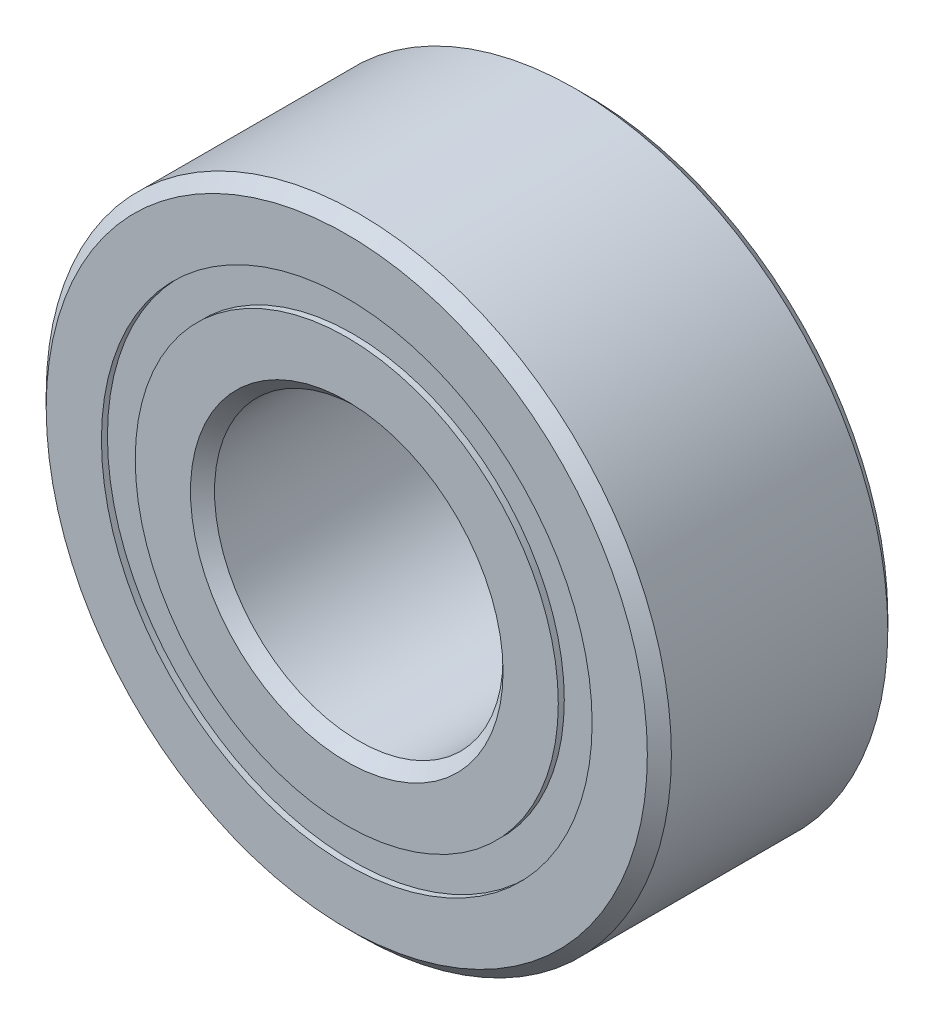
from build123d import *

# Parameters (mm, degrees)
CIRPATTERN1_COUNT = 12
SKETCH5_W         = 1.209571124
SKETCH5_H         = 0.703296704


with BuildPart() as part:
    # Sketch1 → Revolve1 (revolve)
    with BuildSketch(Plane(origin=(0, 0, 0), x_dir=(0, 0, -1), z_dir=(1, 0, 0)), mode=Mode.PRIVATE) as revolve1_sk:
        with BuildLine():
            Line((2.25, 6.5), (-2.25, 6.5))
            Line((-2.25, 6.5), (-2.5, 6.25))
            Line((-2.5, 6.25), (-2.5, 5.101648352))
            Line((-2.5, 5.101648352), (-1.111111111, 5.101648352))
            ThreePointArc((-1.111111111, 5.101648352), (0, 5.915428876), (1.111111111, 5.101648352))
            Line((1.111111111, 5.101648352), (2.5, 5.101648352))
            Line((2.5, 5.101648352), (2.5, 6.25))
            Line((2.5, 6.25), (2.25, 6.5))
        make_face()
    revolve(revolve1_sk.sketch.rotate(Axis((0, 0, 2.5), (0, 0, -1)), 90), axis=Axis((0, 0, 2.5), (0, 0, -1)))


with BuildPart() as body_2:
    # Sketch3 → Revolve3 (revolve)
    with BuildSketch(Plane(origin=(0, 0, 0), x_dir=(0, 0, -1), z_dir=(1, 0, 0)), mode=Mode.PRIVATE) as revolve3_sk:
        with BuildLine():
            Line((-2.5, 4.398351648), (-1.111111111, 4.398351648))
            ThreePointArc((-1.111111111, 4.398351648), (0, 3.584571124), (1.111111111, 4.398351648))
            Line((1.111111111, 4.398351648), (2.5, 4.398351648))
            Line((2.5, 4.398351648), (2.5, 3.25))
            Line((2.5, 3.25), (2.25, 3))
            Line((2.25, 3), (-2.25, 3))
            Line((-2.25, 3), (-2.5, 3.25))
            Line((-2.5, 3.25), (-2.5, 4.398351648))
        make_face()
    revolve(revolve3_sk.sketch.rotate(Axis((0, 0, 2.5), (0, 0, -1)), 90), axis=Axis((0, 0, 2.5), (0, 0, -1)))


with BuildPart() as body_3:
    # Sketch4 → Revolve4 (revolve)
    with BuildSketch(Plane(origin=(0, 0, 0), x_dir=(0, 0, -1), z_dir=(1, 0, 0))):
        with BuildLine():
            Line((-1.165428876, 4.75), (1.165428876, 4.75))
            ThreePointArc((1.165428876, 4.75), (0, 5.915428876), (-1.165428876, 4.75))
        make_face()
    revolve(axis=Axis((0, 4.75, 1.165428876), (0, 0, -1)))


with BuildPart() as cirpattern1_1:
    # CirPattern1: pattern copy
    add(body_3.part.rotate(Axis((0, 0, 0), (0, 0, 1)), 1 * 360 / CIRPATTERN1_COUNT))


with BuildPart() as cirpattern1_2:
    # CirPattern1: pattern copy
    add(body_3.part.rotate(Axis((0, 0, 0), (0, 0, 1)), 2 * 360 / CIRPATTERN1_COUNT))


with BuildPart() as cirpattern1_3:
    # CirPattern1: pattern copy
    add(body_3.part.rotate(Axis((0, 0, 0), (0, 0, 1)), 3 * 360 / CIRPATTERN1_COUNT))


with BuildPart() as cirpattern1_4:
    # CirPattern1: pattern copy
    add(body_3.part.rotate(Axis((0, 0, 0), (0, 0, 1)), 4 * 360 / CIRPATTERN1_COUNT))


with BuildPart() as cirpattern1_5:
    # CirPattern1: pattern copy
    add(body_3.part.rotate(Axis((0, 0, 0), (0, 0, 1)), 5 * 360 / CIRPATTERN1_COUNT))


with BuildPart() as cirpattern1_6:
    # CirPattern1: pattern copy
    add(body_3.part.rotate(Axis((0, 0, 0), (0, 0, 1)), 6 * 360 / CIRPATTERN1_COUNT))


with BuildPart() as cirpattern1_7:
    # CirPattern1: pattern copy
    add(body_3.part.rotate(Axis((0, 0, 0), (0, 0, 1)), 7 * 360 / CIRPATTERN1_COUNT))


with BuildPart() as cirpattern1_8:
    # CirPattern1: pattern copy
    add(body_3.part.rotate(Axis((0, 0, 0), (0, 0, 1)), 8 * 360 / CIRPATTERN1_COUNT))


with BuildPart() as cirpattern1_9:
    # CirPattern1: pattern copy
    add(body_3.part.rotate(Axis((0, 0, 0), (0, 0, 1)), 9 * 360 / CIRPATTERN1_COUNT))


with BuildPart() as cirpattern1_10:
    # CirPattern1: pattern copy
    add(body_3.part.rotate(Axis((0, 0, 0), (0, 0, 1)), 10 * 360 / CIRPATTERN1_COUNT))


with BuildPart() as cirpattern1_11:
    # CirPattern1: pattern copy
    add(body_3.part.rotate(Axis((0, 0, 0), (0, 0, 1)), 11 * 360 / CIRPATTERN1_COUNT))


with BuildPart() as body_15:
    # Sketch5 → Revolve5 (revolve)
    with BuildSketch(Plane(origin=(0, 0, 0), x_dir=(0, 0, -1), z_dir=(1, 0, 0)), mode=Mode.PRIVATE) as revolve5_sk:
        with Locations((-1.770214438, 4.75)):
            Rectangle(SKETCH5_W, SKETCH5_H)
        with Locations((1.770214438, 4.75)):
            Rectangle(SKETCH5_W, SKETCH5_H)
    revolve(revolve5_sk.sketch.rotate(Axis((0, 0, 2.5), (0, 0, -1)), 90), axis=Axis((0, 0, 2.5), (0, 0, -1)))


solid = Compound([part.part, body_2.part, body_3.part, cirpattern1_1.part, cirpattern1_2.part, cirpattern1_3.part, cirpattern1_4.part, cirpattern1_5.part, cirpattern1_6.part, cirpattern1_7.part, cirpattern1_8.part, cirpattern1_9.part, cirpattern1_10.part, cirpattern1_11.part, body_15.part])
